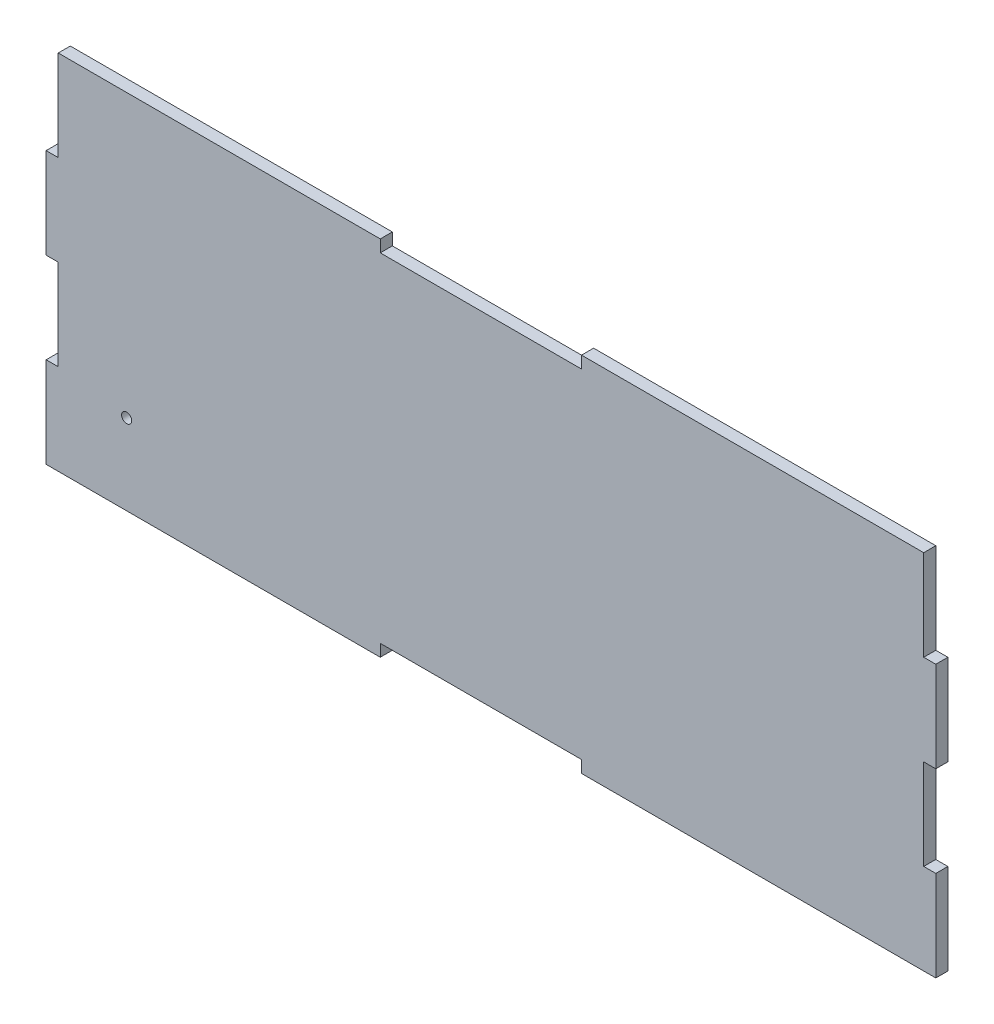
from build123d import *

# Parameters (mm, degrees)
SKETCH1_R           = 1.25
BOSS_EXTRUDE1_DEPTH = 3


with BuildPart() as part:
    # Sketch1 → Boss-Extrude1 (new body)
    with BuildSketch(Plane.XY):
        Polygon((-2, 47), (78, 47), (78, 44), (128, 44), (128, 47), (213, 47), (213, 24.5), (216, 24.5), (216, 2), (213, 2), (213, -20.5), (216, -20.5), (216, -43), (213, -43), (128, -43), (128, -40), (78, -40), (78, -43), (-2, -43), (-5, -43), (-5, -20.5), (-2, -20.5), (-2, 2), (-5, 2), (-5, 24.5), (-2, 24.5), align=None)
        with Locations((15, -23)):
            Circle(SKETCH1_R, mode=Mode.SUBTRACT)
    extrude(amount=BOSS_EXTRUDE1_DEPTH)


solid = part.part
